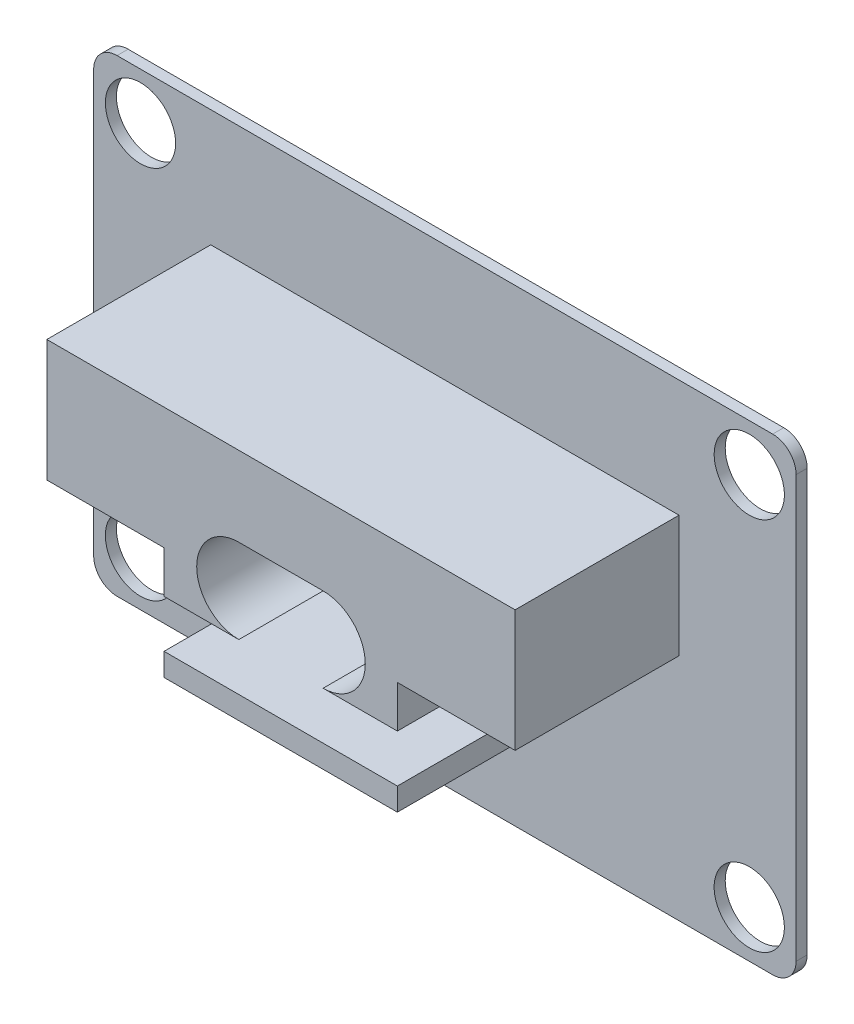
from build123d import *

# Parameters (mm, degrees)
SKETCH1_W           = 38.1
SKETCH1_H           = 25.4
BOSS_EXTRUDE1_DEPTH = 0.6
SKETCH2_W           = 25.4
SKETCH2_H           = 12.7
BOSS_EXTRUDE2_DEPTH = 8.89
CUT_EXTRUDE1_DEPTH  = 25.4
CUT_EXTRUDE2_DEPTH  = 8.89
SKETCH5_R           = 1.905
CUT_EXTRUDE4_DEPTH  = 5.08
FILLET4_R           = 1.27


with BuildPart() as part:
    # Sketch1 → Boss-Extrude1 (new body)
    with BuildSketch(Plane.XY):
        with Locations((19.05, 12.7)):
            Rectangle(SKETCH1_W, SKETCH1_H)
    extrude(amount=BOSS_EXTRUDE1_DEPTH)

    # Sketch2 → Boss-Extrude2 (add)
    with BuildSketch(Plane.XY.offset(0.6)):
        with Locations((19.05, 12.7)):
            Rectangle(SKETCH2_W, SKETCH2_H)
    extrude(amount=BOSS_EXTRUDE2_DEPTH)

    # Sketch3 → Cut-Extrude1 (cut)
    with BuildSketch(Plane.XY.offset(9.49)):
        with BuildLine():
            Line((21.336, 14.732), (16.764, 14.732))
            ThreePointArc((16.764, 14.732), (14.478, 12.446), (16.764, 10.16))
            Line((16.764, 10.16), (21.336, 10.16))
            ThreePointArc((21.336, 10.16), (23.622, 12.446), (21.336, 14.732))
        make_face()
    extrude(amount=-CUT_EXTRUDE1_DEPTH, mode=Mode.SUBTRACT)

    # Sketch3<3> → Cut-Extrude2 (cut)
    with BuildSketch(Plane.XY.offset(9.49)):
        Polygon((21.336, 10.16), (16.764, 10.16), (12.707051154, 10.16), (12.707051154, 12.446), (6.35, 12.446), (6.35, 6.35), (12.707051154, 6.35), (12.707051154, 7.579234478), (25.362079922, 7.579234478), (25.362079922, 6.35), (31.75, 6.35), (31.75, 12.446), (25.362079922, 12.446), (25.362079922, 10.16), align=None)
    extrude(amount=-CUT_EXTRUDE2_DEPTH, mode=Mode.SUBTRACT)

    # Sketch5 → Cut-Extrude4 (cut)
    with BuildSketch(Plane.XY.offset(0.6)):
        with Locations((2.54, 22.86)):
            Circle(SKETCH5_R)
        with Locations(Location((35.56, 22.86, 0), (0, 0, 180))):
            Circle(SKETCH5_R)
        with Locations(Location((2.54, 2.54, 0), (0, 0, 180))):
            Circle(SKETCH5_R)
        with Locations((35.56, 2.54)):
            Circle(SKETCH5_R)
    extrude(amount=-CUT_EXTRUDE4_DEPTH, mode=Mode.SUBTRACT)

    # Fillet4
    fillet4_edges = [part.edges().sort_by_distance(p)[0] for p in [
        (0, 0, 0.3),
        (38.1, 0, 0.3),
        (38.1, 25.4, 0.3),
        (0, 25.4, 0.3),
    ]]
    fillet(fillet4_edges, radius=FILLET4_R)


solid = part.part
